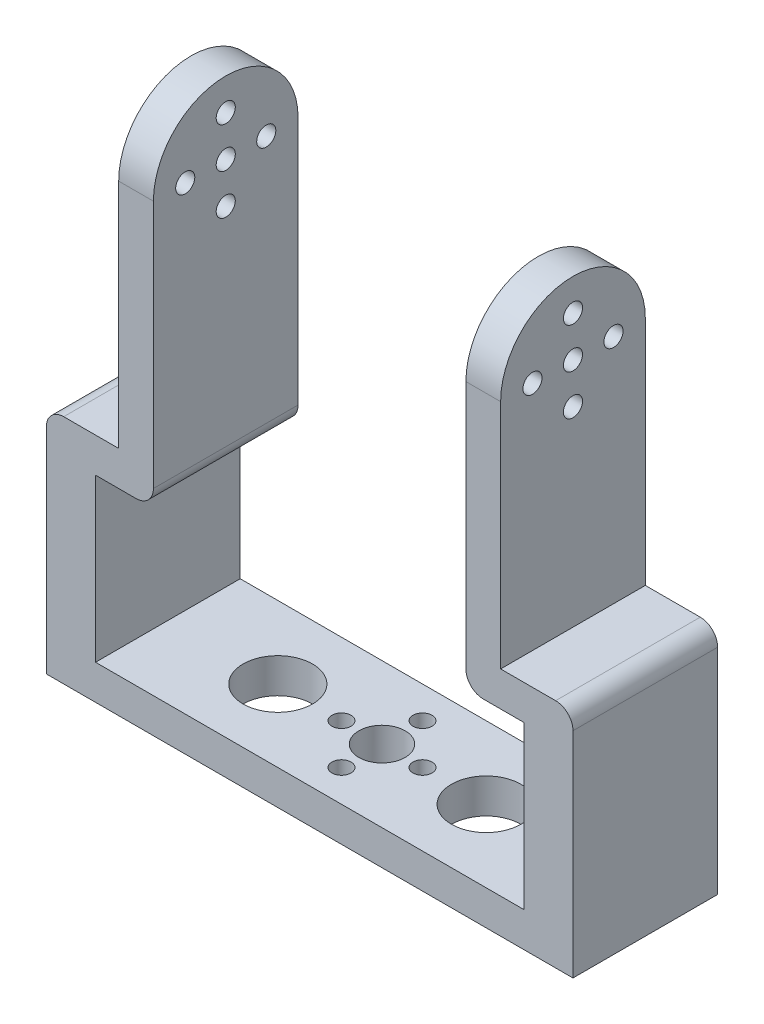
from build123d import *

# Parameters (mm, degrees)
SKETCH_1_W          = 58
SKETCH_1_H          = 25
EXTRUDE_1_DEPTH     = 6
SKETCH_2_R          = 4
SKETCH_2_R_2        = 1.65
CUT_EXTRUDE_1_DEPTH = 2
EXTRUDE_2_DEPTH     = 2
SKETCH_4_R          = 1.65
CUT_EXTRUDE_2_DEPTH = 2
EXTRUDE_3_DEPTH     = 4
SKETCH_5_R          = 1.65
EXTRUDE_4_DEPTH     = 4
SKETCH_4_2_R        = 1.65
CUT_EXTRUDE_3_DEPTH = 6
SKETCH_2_2_R        = 4
SKETCH_2_2_R_2      = 1.65
CUT_EXTRUDE_4_DEPTH = 6
CUT_EXTRUDE_5_REACH = 95.421
SKETCH_6_R          = 6
SKETCH_9_W          = 25
SKETCH_9_H          = 40
EXTRUDE_6_DEPTH     = 12.5
SKETCH_10_W         = 25
SKETCH_10_H         = 28
CUT_EXTRUDE_6_DEPTH = 10
FILLET_1_R          = 3


with BuildPart() as part:
    # 草图1 → 凸台-拉伸1 (new body)
    with BuildSketch(Plane(origin=(0, 0, 0), x_dir=(1, 0, 0), z_dir=(0, 1, 0))):
        Rectangle(SKETCH_1_W, SKETCH_1_H)
    extrude(amount=EXTRUDE_1_DEPTH)

    # 草图2 → 切除-拉伸1 (cut)
    with BuildSketch(Plane(origin=(0, 6, 0), x_dir=(1, 0, 0), z_dir=(0, 1, 0))):
        with Locations(Location((0, 0, 0), (0, 0, 270))):
            Circle(SKETCH_2_R)
        with Locations(Location((0, 7, 0), (0, 0, 270))):
            Circle(SKETCH_2_R_2)
        with Locations(Location((7, 0, 0), (0, 0, 270))):
            Circle(SKETCH_2_R_2)
        with Locations(Location((0, -7, 0), (0, 0, 270))):
            Circle(SKETCH_2_R_2)
        with Locations(Location((-7, 0, 0), (0, 0, 270))):
            Circle(SKETCH_2_R_2)
    extrude(amount=-CUT_EXTRUDE_1_DEPTH, mode=Mode.SUBTRACT)

    # 草图3 → 凸台-拉伸2 (add)
    with BuildSketch(Plane(origin=(29, 0, 0), x_dir=(0, 0, -1), z_dir=(1, 0, 0))):
        with BuildLine():
            Line((0, 6), (12.5, 6))
            Line((12.5, 6), (12.5, 80))
            ThreePointArc((12.5, 80), (0, 92.5), (-12.5, 80))
            Line((-12.5, 80), (-12.5, 6))
            Line((-12.5, 6), (0, 6))
        make_face()
    extrude_2 = extrude(amount=-EXTRUDE_2_DEPTH)

    # 草图4 → 切除-拉伸2 (cut)
    with BuildSketch(Plane(origin=(29, 0, 0), x_dir=(0, 0, -1), z_dir=(1, 0, 0))):
        with Locations((0, 87)):
            Circle(SKETCH_4_R)
        with Locations((7, 80)):
            Circle(SKETCH_4_R)
        with Locations((0, 73)):
            Circle(SKETCH_4_R)
        with Locations((-7, 80)):
            Circle(SKETCH_4_R)
        with Locations((0, 80)):
            Circle(SKETCH_4_R)
    cut_extrude_2 = extrude(amount=-CUT_EXTRUDE_2_DEPTH, mode=Mode.SUBTRACT)

    # 镜向1: 凸台-拉伸2, 切除-拉伸2 across plane
    add(extrude_2.mirror(Plane(origin=(0, 0, 0), x_dir=(0, 0, 1), z_dir=(1, 0, 0))))
    add(cut_extrude_2.mirror(Plane(origin=(0, 0, 0), x_dir=(0, 0, 1), z_dir=(1, 0, 0))), mode=Mode.SUBTRACT)

    # 草图3<3> → 凸台-拉伸3 (add)
    with BuildSketch(Plane(origin=(29, 0, 0), x_dir=(0, 0, -1), z_dir=(1, 0, 0))):
        with BuildLine():
            Line((0, 0), (12.5, 0))
            Line((12.5, 0), (12.5, 80))
            ThreePointArc((12.5, 80), (0, 92.5), (-12.5, 80))
            Line((-12.5, 80), (-12.5, 0))
            Line((-12.5, 0), (0, 0))
        make_face()
    extrude(amount=EXTRUDE_3_DEPTH)

    # 草图5 → 凸台-拉伸4 (add)
    with BuildSketch(Plane.ZY.offset(29)):
        with BuildLine():
            Line((-12.5, 0), (12.5, 0))
            Line((12.5, 0), (12.5, 80))
            ThreePointArc((12.5, 80), (0, 92.5), (-12.5, 80))
            Line((-12.5, 80), (-12.5, 0))
        make_face()
        with Locations(Location((0, 73, 0), (0, 0, 180))):
            Circle(SKETCH_5_R, mode=Mode.SUBTRACT)
        with Locations(Location((0, 87, 0), (0, 0, 180))):
            Circle(SKETCH_5_R, mode=Mode.SUBTRACT)
        with Locations(Location((-7, 80, 0), (0, 0, 180))):
            Circle(SKETCH_5_R, mode=Mode.SUBTRACT)
        with Locations(Location((0, 80, 0), (0, 0, 180))):
            Circle(SKETCH_5_R, mode=Mode.SUBTRACT)
        with Locations(Location((7, 80, 0), (0, 0, 180))):
            Circle(SKETCH_5_R, mode=Mode.SUBTRACT)
    extrude(amount=EXTRUDE_4_DEPTH)

    # 草图4<2> → 切除-拉伸3 (cut)
    with BuildSketch(Plane(origin=(29, 0, 0), x_dir=(0, 0, -1), z_dir=(1, 0, 0))):
        with Locations((0, 87)):
            Circle(SKETCH_4_2_R)
        with Locations((7, 80)):
            Circle(SKETCH_4_2_R)
        with Locations((0, 73)):
            Circle(SKETCH_4_2_R)
        with Locations((-7, 80)):
            Circle(SKETCH_4_2_R)
        with Locations((0, 80)):
            Circle(SKETCH_4_2_R)
    extrude(amount=CUT_EXTRUDE_3_DEPTH, mode=Mode.SUBTRACT)

    # 草图2<2> → 切除-拉伸4 (cut)
    with BuildSketch(Plane(origin=(0, 6, 0), x_dir=(1, 0, 0), z_dir=(0, 1, 0))):
        with Locations(Location((0, 0, 0), (0, 0, 270))):
            Circle(SKETCH_2_2_R)
        with Locations(Location((0, 7, 0), (0, 0, 270))):
            Circle(SKETCH_2_2_R_2)
        with Locations(Location((7, 0, 0), (0, 0, 270))):
            Circle(SKETCH_2_2_R_2)
        with Locations(Location((0, -7, 0), (0, 0, 270))):
            Circle(SKETCH_2_2_R_2)
        with Locations(Location((-7, 0, 0), (0, 0, 270))):
            Circle(SKETCH_2_2_R_2)
    extrude(amount=-CUT_EXTRUDE_4_DEPTH, mode=Mode.SUBTRACT)

    # 草图6 → 切除-拉伸5 (cut, up to next)
    with BuildSketch(Plane(origin=(0, 6, 0), x_dir=(1, 0, 0), z_dir=(0, 1, 0)), mode=Mode.PRIVATE) as cut_extrude_5_sk1:
        with Locations(Location((-18, 0, 0), (0, 0, 270))):
            Circle(SKETCH_6_R)
    cut_extrude_5_tool1 = extrude(cut_extrude_5_sk1.sketch, amount=-CUT_EXTRUDE_5_REACH, mode=Mode.PRIVATE) & part.part
    # 草图6 → 切除-拉伸5 (cut, up to next)
    with BuildSketch(Plane(origin=(0, 6, 0), x_dir=(1, 0, 0), z_dir=(0, 1, 0)), mode=Mode.PRIVATE) as cut_extrude_5_sk2:
        with Locations(Location((18, 0, 0), (0, 0, 270))):
            Circle(SKETCH_6_R)
    cut_extrude_5_tool2 = extrude(cut_extrude_5_sk2.sketch, amount=-CUT_EXTRUDE_5_REACH, mode=Mode.PRIVATE) & part.part
    add(cut_extrude_5_tool1.solids().sort_by_distance((-18, 6, 0))[0], mode=Mode.SUBTRACT)
    add(cut_extrude_5_tool2.solids().sort_by_distance((18, 6, 0))[0], mode=Mode.SUBTRACT)

    # 草图9 → 凸台-拉伸6 (add)
    with BuildSketch(Plane(origin=(33, 0, 0), x_dir=(0, 0, -1), z_dir=(1, 0, 0))):
        with Locations((0, 20)):
            Rectangle(SKETCH_9_W, SKETCH_9_H)
    extrude_6 = extrude(amount=EXTRUDE_6_DEPTH)

    # 镜向2: 凸台-拉伸6 across plane
    add(extrude_6.mirror(Plane(origin=(0, 0, 0), x_dir=(0, 0, 1), z_dir=(1, 0, 0))))

    # 草图10 → 切除-拉伸6 (cut)
    with BuildSketch(Plane.ZY.offset(-27)):
        with Locations((0, 20)):
            Rectangle(SKETCH_10_W, SKETCH_10_H)
    cut_extrude_6 = extrude(amount=-CUT_EXTRUDE_6_DEPTH, mode=Mode.SUBTRACT)

    # 镜向3: 切除-拉伸6 across plane
    add(cut_extrude_6.mirror(Plane(origin=(0, 0, 0), x_dir=(0, 0, 1), z_dir=(1, 0, 0))), mode=Mode.SUBTRACT)

    # 圆角1
    fillet_1_edges = [part.edges().sort_by_distance(p)[0] for p in [
        (45.5, 40, 0),
        (-45.5, 40, 0),
        (27, 34, 0),
        (-27, 34, 0),
    ]]
    fillet(fillet_1_edges, radius=FILLET_1_R)


solid = part.part
